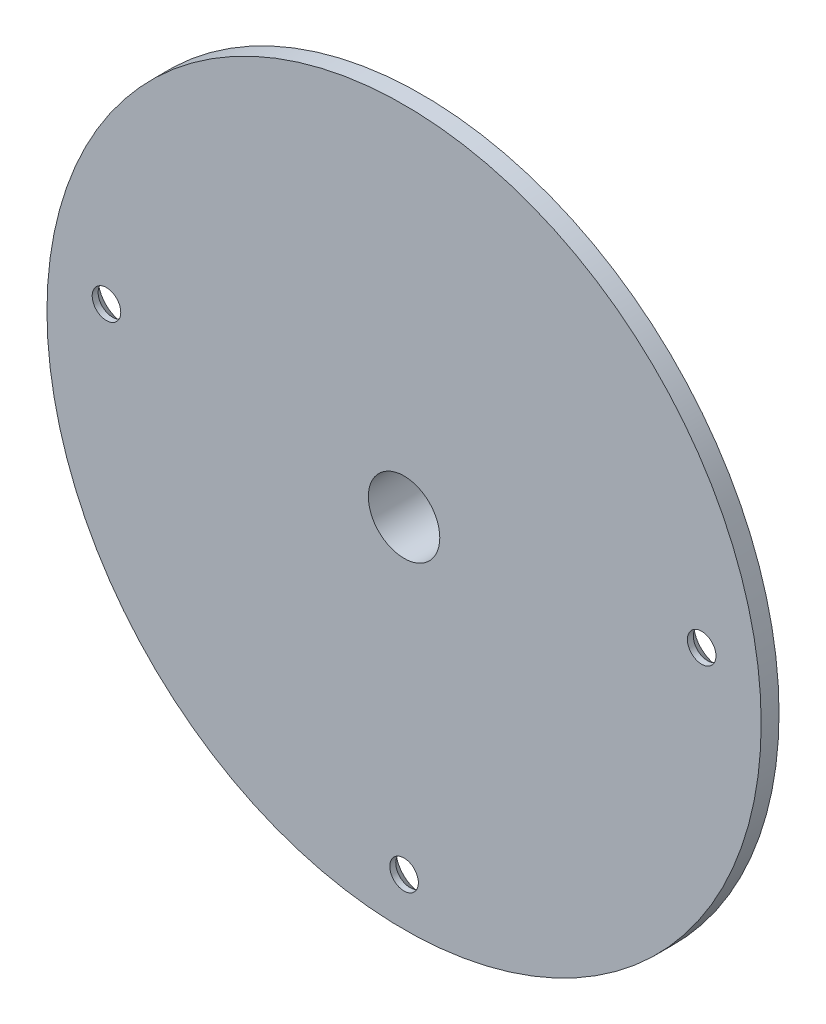
from build123d import *
from build123d.topology import SkipClean

# Parameters (mm, degrees)
SCHIZZO1_R                             = 30
SCHIZZO1_R_2                           = 3
ESTRUSIONE_ESTRUSIONE1_DEPTH           = 1.5
FORO_SVASATO_PER_VITE_M2_1_D           = 2.4
FORO_SVASATO_PER_VITE_M2_1_DEPTH       = 6
FORO_SVASATO_PER_VITE_M2_1_CSINK_D     = 4.4
FORO_SVASATO_PER_VITE_M2_1_CSINK_ANGLE = 90
FORO_SVASATO_PER_VITE_M2_1_TIP         = 0.721032743
SCHIZZO5_R                             = 4.5
ESTRUSIONE_ESTRUSIONE2_DEPTH           = 4
SCHIZZO9_R                             = 3
TAGLIO_ESTRUSIONE1_DEPTH               = 10


with BuildPart() as part:
    # Schizzo1 → Estrusione-Estrusione1 (new body)
    with BuildSketch(Plane.XY):
        Circle(SCHIZZO1_R)
        Circle(SCHIZZO1_R_2, mode=Mode.SUBTRACT)
    extrude(amount=ESTRUSIONE_ESTRUSIONE1_DEPTH)

    # Foro svasato per Vite M2-1
    with Locations(Plane(origin=(0, 0, 0), x_dir=(-1, 0, 0), z_dir=(0, 0, -1))):
        with Locations((0, -26), (-25, 3), (25, 3)):
            CounterSinkHole(FORO_SVASATO_PER_VITE_M2_1_D / 2, FORO_SVASATO_PER_VITE_M2_1_CSINK_D / 2, depth=FORO_SVASATO_PER_VITE_M2_1_DEPTH, counter_sink_angle=FORO_SVASATO_PER_VITE_M2_1_CSINK_ANGLE)
            with Locations((0, 0, -(FORO_SVASATO_PER_VITE_M2_1_DEPTH + FORO_SVASATO_PER_VITE_M2_1_TIP / 2))):  # 118° drill point
                Cone(0, FORO_SVASATO_PER_VITE_M2_1_D / 2, FORO_SVASATO_PER_VITE_M2_1_TIP, mode=Mode.SUBTRACT)

    # Schizzo5 → Estrusione-Estrusione2 (add)
    with BuildSketch(Plane(origin=(0, 0, 0), x_dir=(-1, 0, 0), z_dir=(0, 0, -1))):
        with Locations(Location((0, 0, 0), (0, 0, 180))):
            Circle(SCHIZZO5_R)
    extrude(amount=ESTRUSIONE_ESTRUSIONE2_DEPTH)

    # Schizzo9 → Taglio-Estrusione1 (cut)
    with SkipClean():  # the faces are left unmerged after this step: merging them gives an invalid solid
        with BuildSketch(Plane(origin=(0, 0, -4), x_dir=(-1, 0, 0), z_dir=(0, 0, -1))):
            Circle(SCHIZZO9_R)
        extrude(amount=-TAGLIO_ESTRUSIONE1_DEPTH, mode=Mode.SUBTRACT)


solid = part.part
